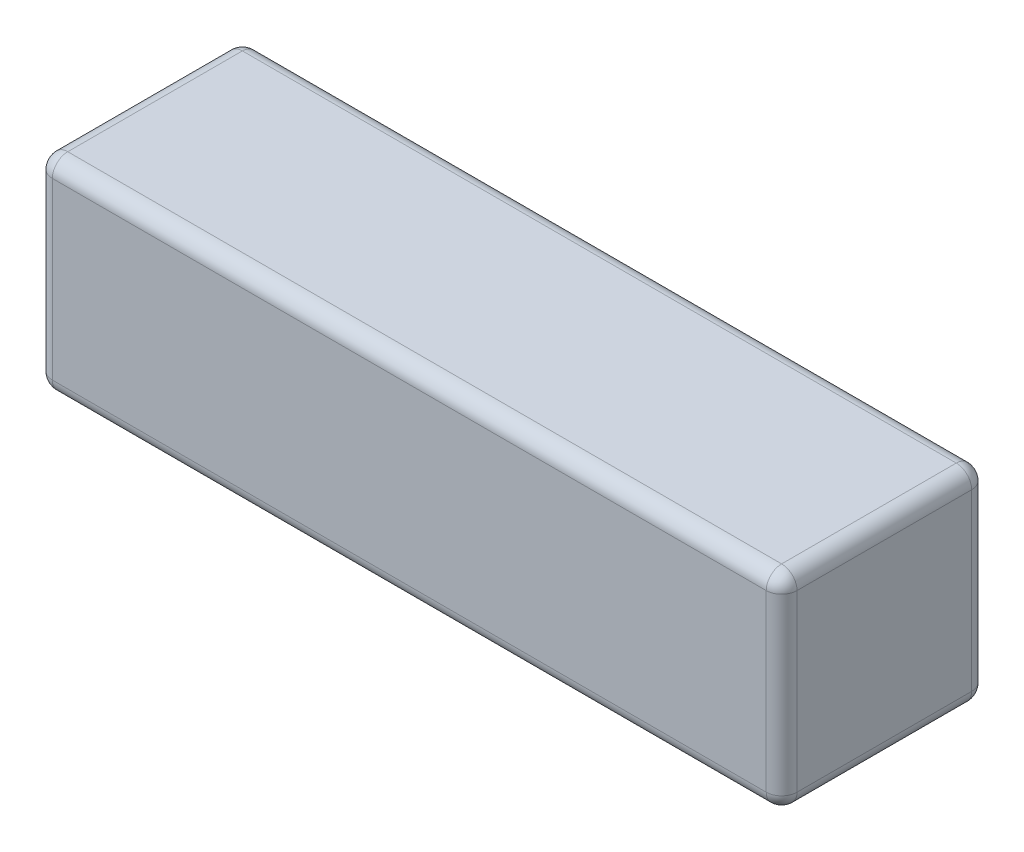
from build123d import *

# Parameters (mm, degrees)
SKETCH_1_W      = 145
SKETCH_1_H      = 40
EXTRUDE_1_DEPTH = 40
FILLET_1_R      = 3
FILLET_2_R      = 3


with BuildPart() as part:
    # 草图1 → 凸台-拉伸1 (new body)
    with BuildSketch(Plane(origin=(0, 0, 0), x_dir=(1, 0, 0), z_dir=(0, 1, 0))):
        Rectangle(SKETCH_1_W, SKETCH_1_H)
    extrude(amount=EXTRUDE_1_DEPTH)

    # 圆角1
    fillet_1_edges = [part.edges().sort_by_distance(p)[0] for p in [
        (0, 40, -20),
        (0, 0, -20),
        (0, 0, 20),
        (0, 40, 20),
    ]]
    fillet(fillet_1_edges, radius=FILLET_1_R)

    # 圆角2
    fillet_2_edges = [part.edges().sort_by_distance(p)[0] for p in [
        (-72.5, 20, -20),
        (72.5, 20, -20),
        (-72.5, 0, 0),
        (-72.5, 20, 20),
        (-72.5, 40, 0),
        (-72.5, 39.121320344, 19.121320344),
        (-72.5, 0.878679656, 19.121320344),
        (-72.5, 39.121320344, -19.121320344),
        (-72.5, 0.878679656, -19.121320344),
        (72.5, 0, 0),
        (72.5, 40, 0),
        (72.5, 20, 20),
        (72.5, 39.121320344, 19.121320344),
        (72.5, 0.878679656, 19.121320344),
        (72.5, 39.121320344, -19.121320344),
        (72.5, 0.878679656, -19.121320344),
    ]]
    fillet(fillet_2_edges, radius=FILLET_2_R)


solid = part.part
